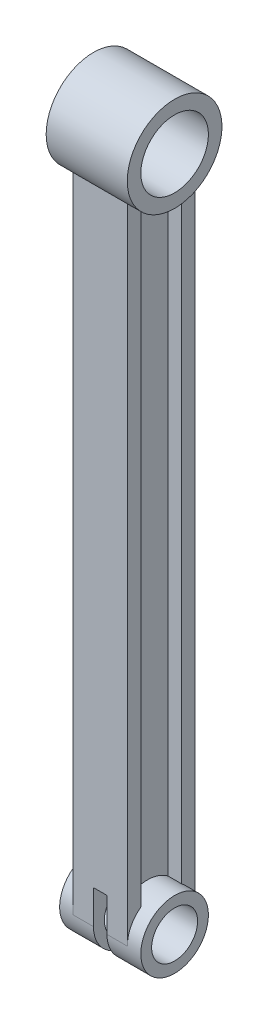
from build123d import *

# Parameters (mm, degrees)
BOSS_EXTRUDE1_DEPTH      = 250
BOSS_EXTRUDE2_DEPTH      = 10
BOSS_EXTRUDE2_DEPTH_BACK = 20
SKETCH2_R                = 12.5
SKETCH3_R                = 8.5
CUT_EXTRUDE1_DEPTH       = 253.586618806
BOSS_EXTRUDE3_DEPTH      = 10
BOSS_EXTRUDE3_DEPTH_BACK = 20
SKETCH4_R                = 17.5
SKETCH5_R                = 12.5
CUT_EXTRUDE2_DEPTH       = 271.335439778
CUT_EXTRUDE3_START       = 12.5
SKETCH6_W                = 5
SKETCH6_H                = 40
CUT_EXTRUDE3_DEPTH       = 39


with BuildPart() as part:
    # Sketch1 → Boss-Extrude1 (new body)
    with BuildSketch(Plane(origin=(0, 0, 0), x_dir=(1, 0, 0), z_dir=(0, 1, 0))):
        Polygon((0, 0), (0, 15), (-5, 15), (-5, 20), (15, 20), (15, 15), (10, 15), (10, 0), (15, 0), (15, -5), (-5, -5), (-5, 0), align=None)
    extrude(amount=BOSS_EXTRUDE1_DEPTH)

    # Sketch2 → Boss-Extrude2 (add, two sides: drawn at the far end of the back side and taken through both)
    with BuildSketch(Plane(origin=(10, 0, 0), x_dir=(0, 0, -1), z_dir=(1, 0, 0)).offset(-BOSS_EXTRUDE2_DEPTH_BACK)):
        with Locations((7.5, 0)):
            Circle(SKETCH2_R)
    extrude(amount=BOSS_EXTRUDE2_DEPTH + BOSS_EXTRUDE2_DEPTH_BACK)

    # Sketch3 → Cut-Extrude1 (cut, through all)
    with BuildSketch(Plane(origin=(20, 0, 0), x_dir=(0, 0, -1), z_dir=(1, 0, 0))):
        with Locations((7.5, 0)):
            Circle(SKETCH3_R)
    extrude(amount=-CUT_EXTRUDE1_DEPTH, mode=Mode.SUBTRACT)

    # Sketch4 → Boss-Extrude3 (add, two sides: drawn at the far end of the back side and taken through both)
    with BuildSketch(Plane.ZY.offset(-BOSS_EXTRUDE3_DEPTH_BACK)):
        with Locations((-7.5, 250)):
            Circle(SKETCH4_R)
    extrude(amount=BOSS_EXTRUDE3_DEPTH + BOSS_EXTRUDE3_DEPTH_BACK)

    # Sketch5 → Cut-Extrude2 (cut, through all)
    with BuildSketch(Plane(origin=(20, 0, 0), x_dir=(0, 0, -1), z_dir=(1, 0, 0))):
        with Locations((7.5, 250)):
            Circle(SKETCH5_R)
    extrude(amount=-CUT_EXTRUDE2_DEPTH, mode=Mode.SUBTRACT)

    # Sketch6 → Cut-Extrude3 (cut)
    with BuildSketch(Plane(origin=(0, 0, 0), x_dir=(1, 0, 0), z_dir=(0, 1, 0)).offset(CUT_EXTRUDE3_START)):
        with Locations((5, 5)):
            Rectangle(SKETCH6_W, SKETCH6_H)
    extrude(amount=-CUT_EXTRUDE3_DEPTH, mode=Mode.SUBTRACT)


solid = part.part
